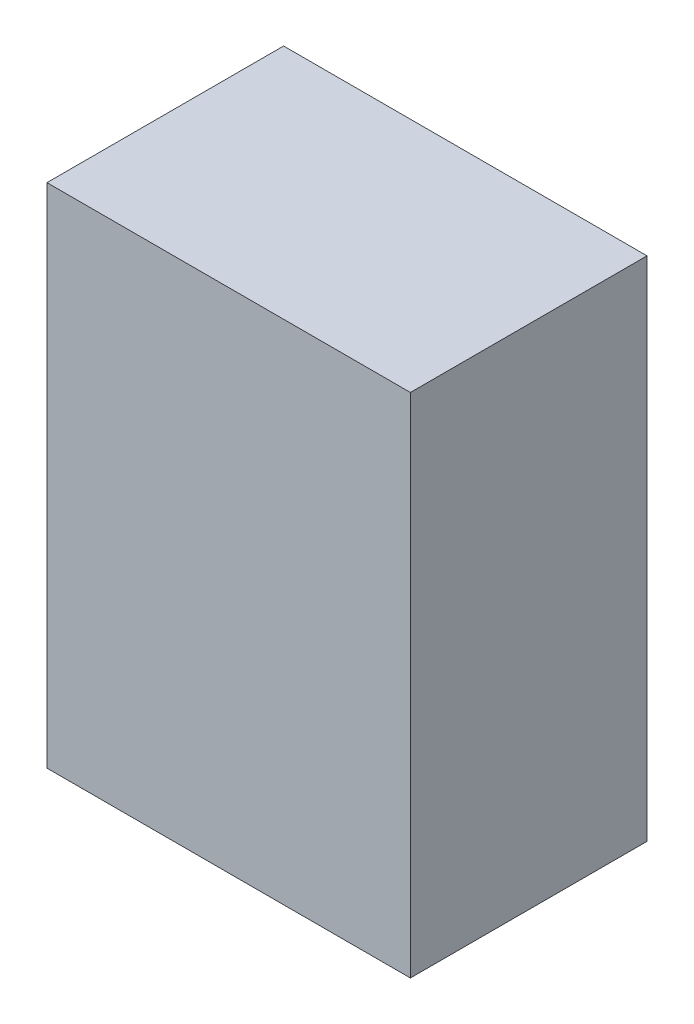
from build123d import *

# Parameters (mm, degrees)
SKETCH1_W      = 546.1
SKETCH1_H      = 355.6
EXTRUDE1_DEPTH = 762


with BuildPart() as part:
    # Sketch1 → Extrude1 (new body)
    with BuildSketch(Plane(origin=(0, 0, 0), x_dir=(1, 0, 0), z_dir=(0, 1, 0))):
        with Locations((273.05, 177.8)):
            Rectangle(SKETCH1_W, SKETCH1_H)
    extrude(amount=EXTRUDE1_DEPTH)


solid = part.part
